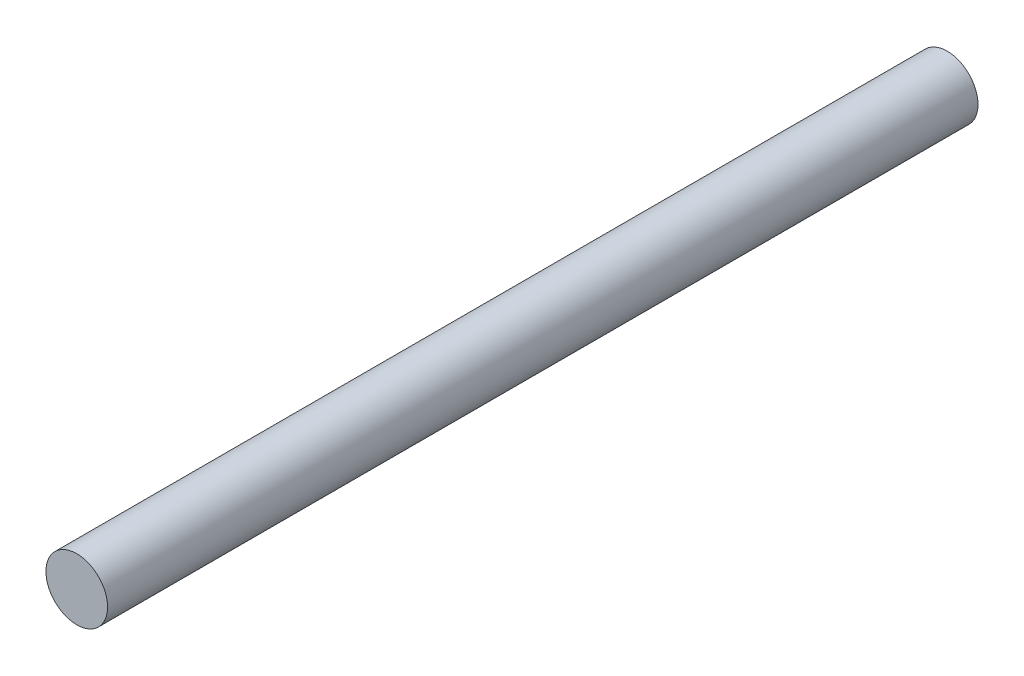
from build123d import *

# Parameters (mm, degrees)
SKETCH1_R           = 4
BOSS_EXTRUDE1_DEPTH = 113


with BuildPart() as part:
    # Sketch1 → Boss-Extrude1 (new body)
    with BuildSketch(Plane.XY):
        Circle(SKETCH1_R)
    extrude(amount=BOSS_EXTRUDE1_DEPTH)


solid = part.part
